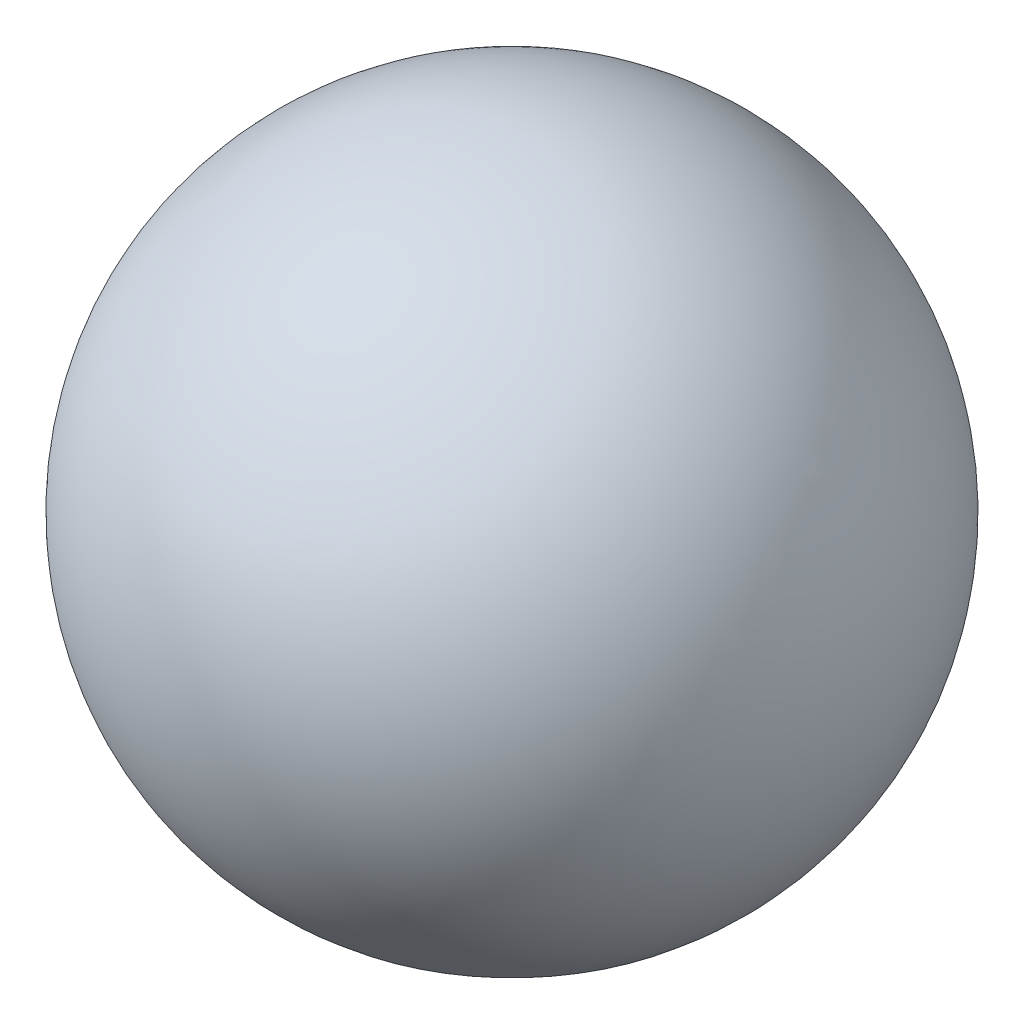
from build123d import *


with BuildPart() as part:
    # Esboço1 → Revolução1 (revolve)
    with BuildSketch(Plane.XY):
        with BuildLine():
            Line((1054.286014324, 0), (1070.522769492, 0))
            ThreePointArc((1070.522769492, 0), (1634.620751122, 1925.493601023), (0, 3089))
            Line((0, 3089), (0, 3079))
            ThreePointArc((0, 3079), (1627.249212628, 1916.189375347), (1054.286014324, 0))
        make_face()
    revolve(axis=Axis((0, 0, 0), (0, 1, 0)))


solid = part.part
